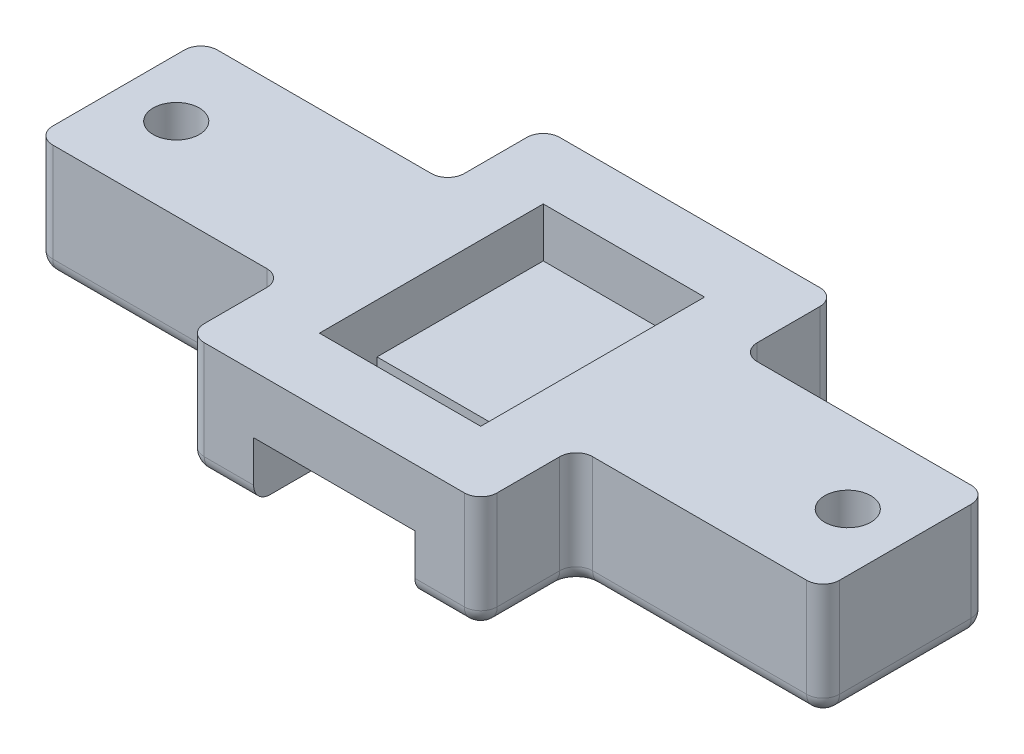
from build123d import *

# Parameters (mm, degrees)
SKETCH1_W                 = 9.8
SKETCH1_H                 = 3.5
BASE_DEPTH                = 7
SKETCH2_W                 = 9.8
SKETCH2_H                 = 13.6
PCB_CUTOUT_DEPTH          = 3
SKETCH5_R                 = 1.4
SCREW_HOLES_DEPTH         = 28.14498112
SKETCH6_W                 = 9.8
SKETCH6_H                 = 4
PIN_HEADERS_OPENING_DEPTH = 3.5
F_1MM_EDGE_FILLETS_R      = 1


with BuildPart() as part:
    # Sketch1 → Base (new body)
    with BuildSketch(Plane(origin=(0, 0, 0), x_dir=(1, 0, 0), z_dir=(0, 1, 0))):
        Polygon((-8.9, 10.8), (-8.9, 5), (-23.9, 5), (-23.9, -5), (-8.9, -5), (-8.9, -10.8), (8.9, -10.8), (8.9, -5), (23.9, -5), (23.9, 5), (8.9, 5), (8.9, 10.8), (0, 10.8), align=None)
        with Locations((0, -5.05)):
            Rectangle(SKETCH1_W, SKETCH1_H, mode=Mode.SUBTRACT)
    extrude(amount=BASE_DEPTH)

    # Sketch2 → PCB Cutout (cut)
    with BuildSketch(Plane(origin=(0, 7, 0), x_dir=(1, 0, 0), z_dir=(0, 1, 0))):
        Rectangle(SKETCH2_W, SKETCH2_H)
    extrude(amount=-PCB_CUTOUT_DEPTH, mode=Mode.SUBTRACT)

    # Sketch5 → Screw Holes (cut, through all)
    with BuildSketch(Plane.XZ):
        with Locations((-20.4, 0)):
            Circle(SKETCH5_R)
        with Locations((20.4, 0)):
            Circle(SKETCH5_R)
    extrude(amount=-SCREW_HOLES_DEPTH, mode=Mode.SUBTRACT)

    # Sketch6 → Pin Headers Opening (cut)
    with BuildSketch(Plane.XZ):
        with Locations((0, 8.8)):
            Rectangle(SKETCH6_W, SKETCH6_H)
    extrude(amount=-PIN_HEADERS_OPENING_DEPTH, mode=Mode.SUBTRACT)

    # 1mm Edge Fillets
    f_1mm_edge_fillets_edges = [part.edges().sort_by_distance(p)[0] for p in [
        (-8.9, 3.5, -10.8),
        (8.9, 3.5, -10.8),
        (8.9, 3.5, -5),
        (23.9, 3.5, -5),
        (23.9, 3.5, 5),
        (8.9, 3.5, 5),
        (8.9, 3.5, 10.8),
        (-8.9, 3.5, 10.8),
        (-8.9, 3.5, 5),
        (-8.9, 3.5, -5),
        (-23.9, 3.5, -5),
        (-23.9, 3.5, 5),
        (-8.9, 0, 7.9),
        (-8.9, 0, -7.9),
        (8.9, 0, -7.9),
        (8.9, 0, 7.9),
        (6.9, 0, 10.8),
        (-6.9, 0, 10.8),
        (-16.4, 0, 5),
        (-23.9, 0, 0),
        (-16.4, 0, -5),
        (0, 0, -10.8),
        (16.4, 0, -5),
        (23.9, 0, 0),
        (16.4, 0, 5),
    ]]
    fillet(f_1mm_edge_fillets_edges, radius=F_1MM_EDGE_FILLETS_R)


solid = part.part
